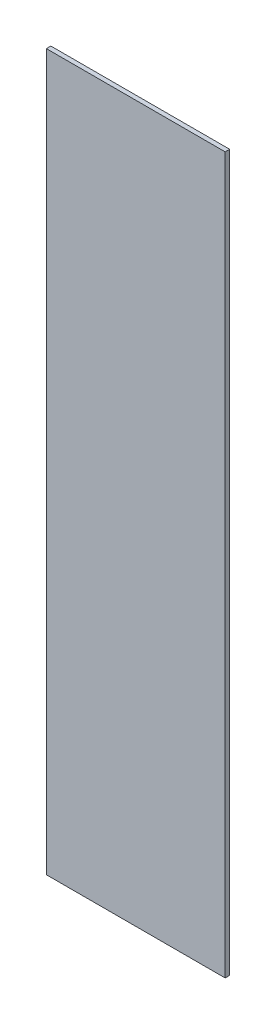
from build123d import *

# Parameters (mm, degrees)
CROQUIS1_W              = 127
CROQUIS1_H              = 508
SALIENTE_EXTRUIR1_DEPTH = 3.175


with BuildPart() as part:
    # Croquis1 → Saliente-Extruir1 (new body)
    with BuildSketch(Plane.XY):
        with Locations((63.5, 254)):
            Rectangle(CROQUIS1_W, CROQUIS1_H)
    extrude(amount=SALIENTE_EXTRUIR1_DEPTH)


solid = part.part
